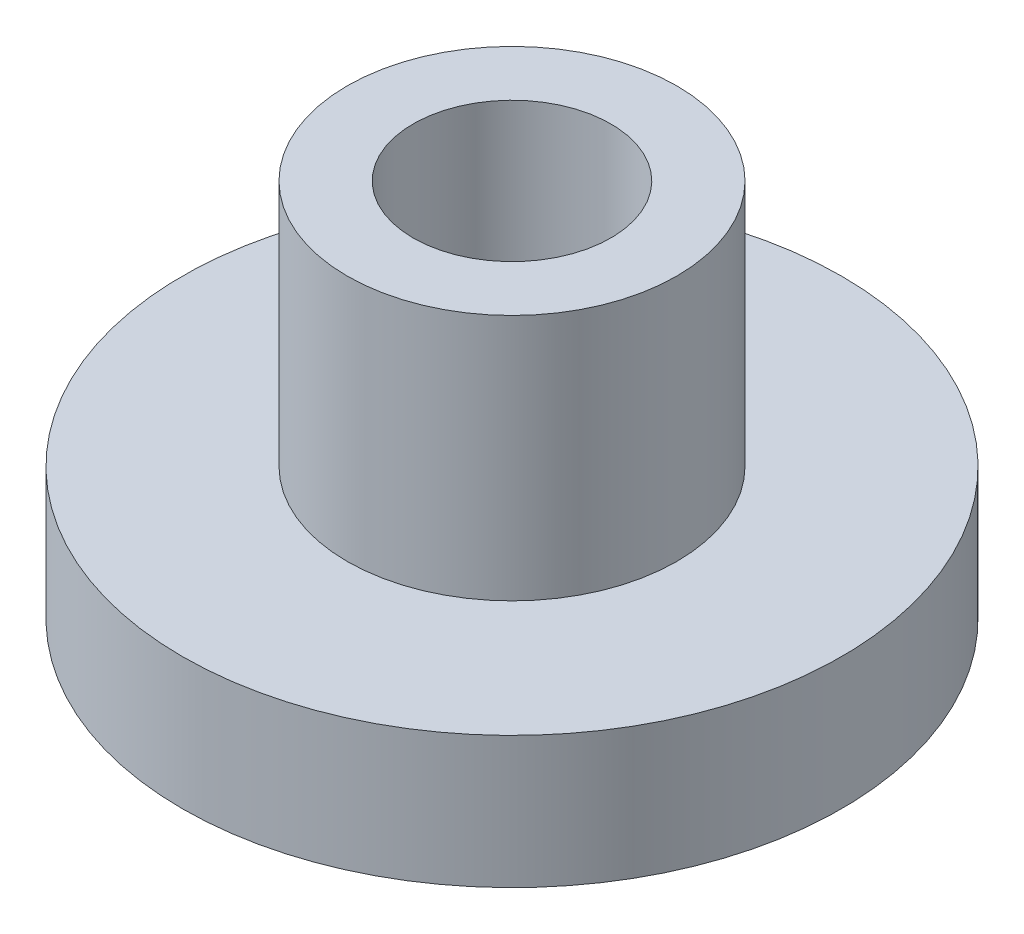
from build123d import *

# Parameters (mm, degrees)
SKETCH1_R           = 5
BOSS_EXTRUDE1_DEPTH = 2
SKETCH2_R           = 2.5
BOSS_EXTRUDE2_DEPTH = 3.75
SKETCH3_R           = 1.5
CUT_EXTRUDE1_DEPTH  = 4


with BuildPart() as part:
    # Sketch1 → Boss-Extrude1 (new body)
    with BuildSketch(Plane(origin=(0, 0, 0), x_dir=(1, 0, 0), z_dir=(0, 1, 0))):
        with Locations(Location((0, 0, 0), (0, 0, 270))):
            Circle(SKETCH1_R)
    extrude(amount=BOSS_EXTRUDE1_DEPTH)

    # Sketch2 → Boss-Extrude2 (add)
    with BuildSketch(Plane(origin=(0, 2, 0), x_dir=(1, 0, 0), z_dir=(0, 1, 0))):
        with Locations(Location((0, 0, 0), (0, 0, 270))):
            Circle(SKETCH2_R)
    extrude(amount=BOSS_EXTRUDE2_DEPTH)

    # Sketch3 → Cut-Extrude1 (cut)
    with BuildSketch(Plane(origin=(0, 5.75, 0), x_dir=(1, 0, 0), z_dir=(0, 1, 0))):
        with Locations(Location((0, 0, 0), (0, 0, 270))):
            Circle(SKETCH3_R)
    extrude(amount=-CUT_EXTRUDE1_DEPTH, mode=Mode.SUBTRACT)


solid = part.part
